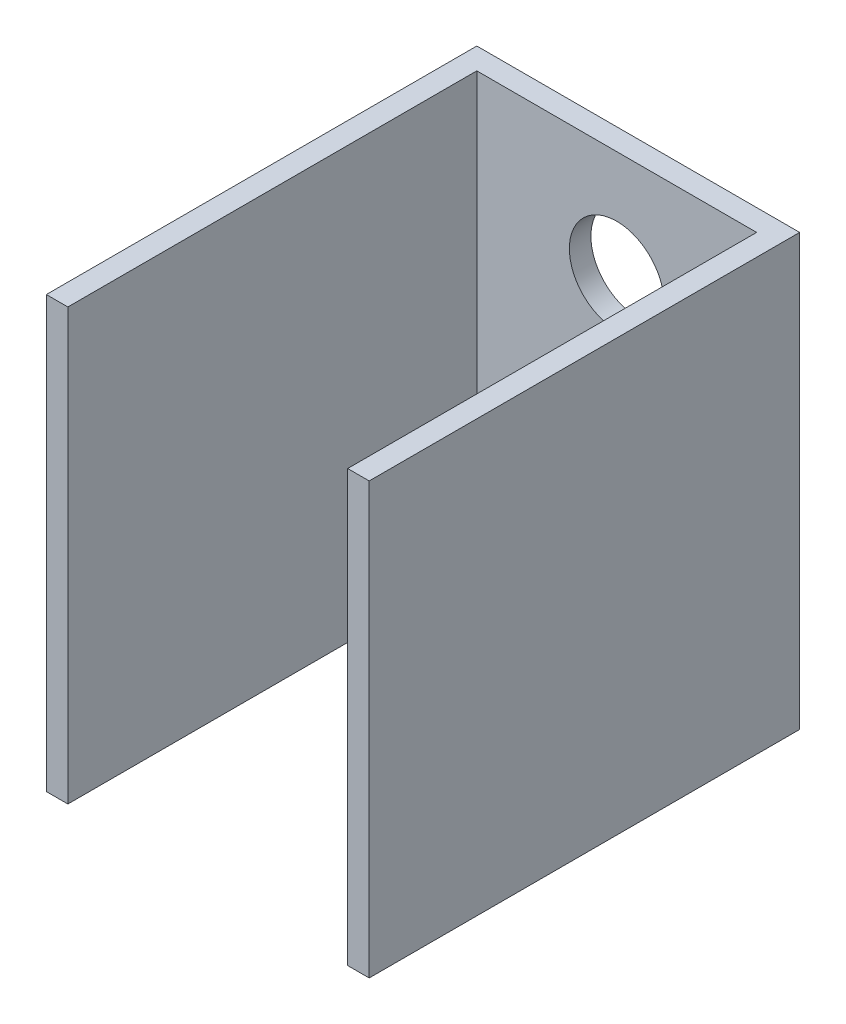
from build123d import *

# Parameters (mm, degrees)
SALIENTE_EXTRUIR1_DEPTH                             = 20
CBORE_FOR_M2_HEX_SOCKET_HEAD_CAP_SCREW1_D           = 2.4
CBORE_FOR_M2_HEX_SOCKET_HEAD_CAP_SCREW1_CBORE_D     = 4.4
CBORE_FOR_M2_HEX_SOCKET_HEAD_CAP_SCREW1_CBORE_DEPTH = 2.4


with BuildPart() as part:
    # Croquis1 → Saliente-Extruir1 (new body)
    with BuildSketch(Plane(origin=(0, 0, 0), x_dir=(1, 0, 0), z_dir=(0, 1, 0))):
        Polygon((6.5, -10), (7.5, -10), (7.5, 10), (-7.5, 10), (-7.5, -10), (-6.5, -10), (-6.5, 9), (6.5, 9), align=None)
    extrude(amount=SALIENTE_EXTRUIR1_DEPTH)

    # CBORE for M2 Hex Socket Head Cap Screw1 (through all)
    with Locations(Plane.XY.offset(-9)):
        with Locations((0, 15)):
            CounterBoreHole(CBORE_FOR_M2_HEX_SOCKET_HEAD_CAP_SCREW1_D / 2, CBORE_FOR_M2_HEX_SOCKET_HEAD_CAP_SCREW1_CBORE_D / 2, CBORE_FOR_M2_HEX_SOCKET_HEAD_CAP_SCREW1_CBORE_DEPTH)


solid = part.part
